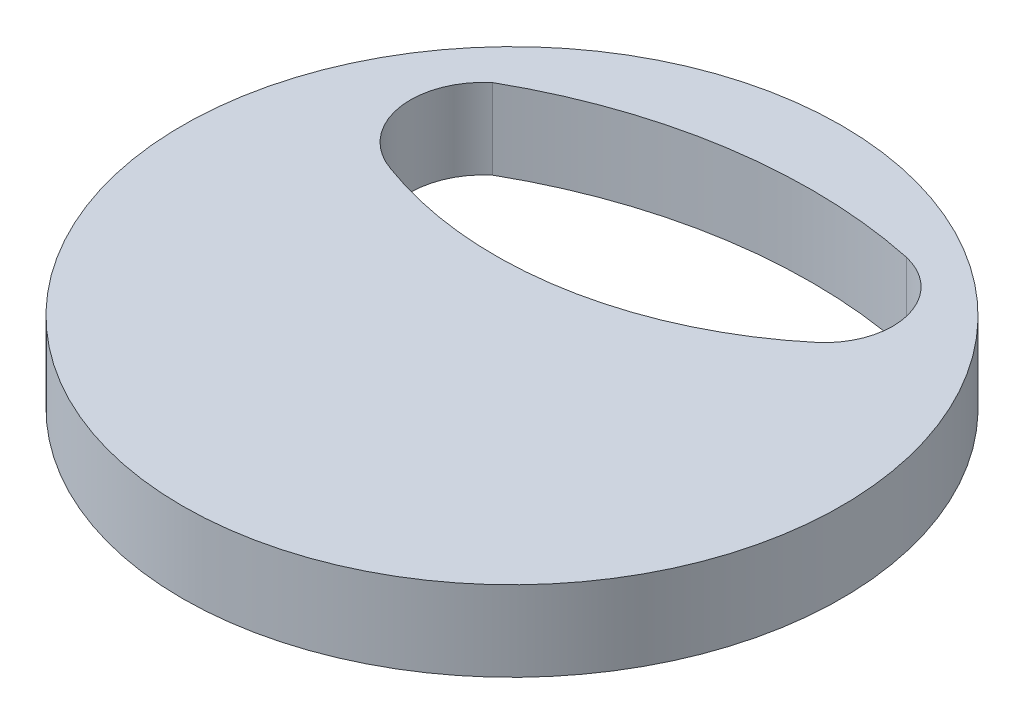
from build123d import *

# Parameters (mm, degrees)
SKETCH1_R           = 7.4
BOSS_EXTRUDE1_DEPTH = 1.8
CUT_EXTRUDE1_DEPTH  = 1.8


with BuildPart() as part:
    # Sketch1 → Boss-Extrude1 (new body)
    with BuildSketch(Plane(origin=(0, 0, 0), x_dir=(1, 0, 0), z_dir=(0, 1, 0))):
        with Locations(Location((0, 0, 0), (0, 0, 270))):
            Circle(SKETCH1_R)
    extrude(amount=BOSS_EXTRUDE1_DEPTH)

    # Sketch2 → Cut-Extrude1 (cut)
    with BuildSketch(Plane(origin=(0, 1.8, 0), x_dir=(1, 0, 0), z_dir=(0, 1, 0))):
        with BuildLine():
            ThreePointArc((-4.755212935, 4.313856299), (-5.309945757, 2.75198404), (-4.225699922, 1.498355538))
            ThreePointArc((-4.225699922, 1.498355538), (0.050751504, 1.102448618), (3.947663446, 2.907678911))
            ThreePointArc((3.947663446, 2.907678911), (4.435061032, 4.439617566), (3.288226484, 5.566188899))
            ThreePointArc((3.288226484, 5.566188899), (-0.848218313, 5.676875006), (-4.755212935, 4.313856299))
        make_face()
    extrude(amount=-CUT_EXTRUDE1_DEPTH, mode=Mode.SUBTRACT)


solid = part.part
